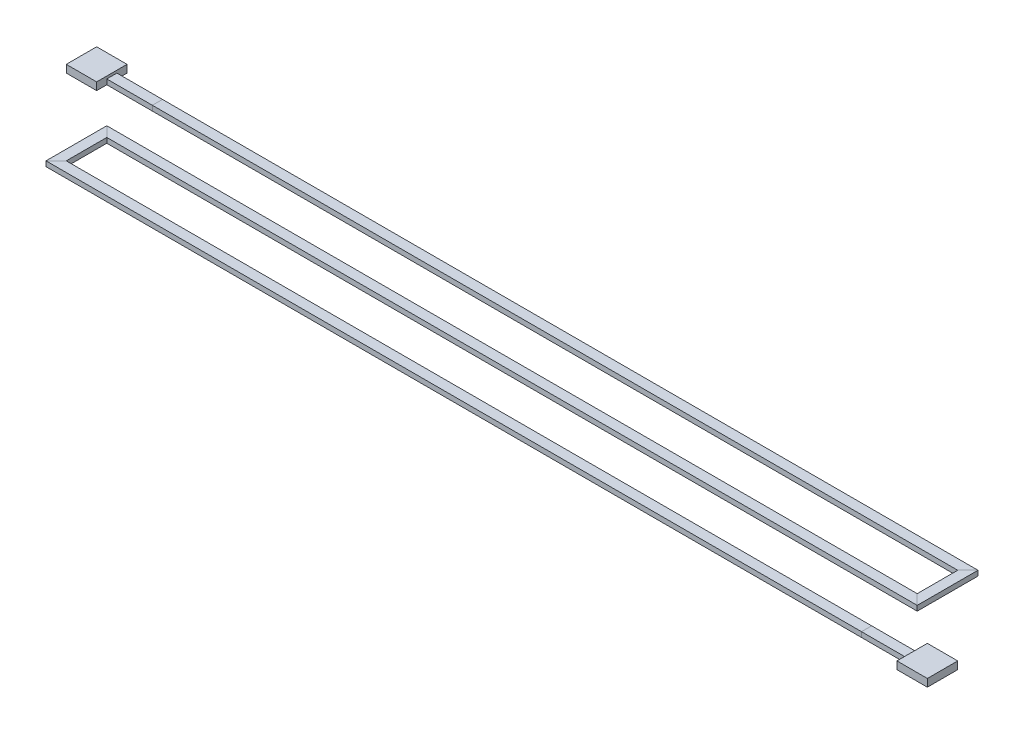
from build123d import *

# Parameters (mm, degrees)
SKETCH2_W           = 1
SKETCH2_H           = 0.5
SKETCH3_W           = 3
SKETCH3_H           = 3
BOSS_EXTRUDE1_DEPTH = 0.75


with BuildPart() as part:
    # Sweep1: sweep along a path in Sketch1
    with BuildLine(Plane(origin=(0, 0, 0), x_dir=(1, 0, 0), z_dir=(0, 1, 0))) as sweep1_path:
        Line((-46.555555556, 5), (-40.555555556, 5))
        Line((-40.555555556, 5), (39.444444444, 5))
        Line((39.444444444, 5), (39.444444444, 0))
        Line((39.444444444, 0), (-40.555555556, 0))
        Line((-40.555555556, 0), (-40.555555556, -5))
        Line((-40.555555556, -5), (39.444444444, -5))
        Line((39.444444444, -5), (45.444444444, -5))
    # Sketch2 → Sweep1 (sweep)
    with BuildSketch(Plane(origin=(45.444444444, 0, 0), x_dir=(0, 0, -1), z_dir=(1, 0, 0))):
        with Locations((-5, 0)):
            Rectangle(SKETCH2_W, SKETCH2_H)
    sweep(path=sweep1_path.line, transition=Transition.RIGHT)

    # Sketch3 → Boss-Extrude1 (add)
    with BuildSketch(Plane.XZ.offset(0.25)):
        with Locations((-46.555555556, -5)):
            Rectangle(SKETCH3_W, SKETCH3_H)
        with Locations((45.444444444, 5)):
            Rectangle(SKETCH3_W, SKETCH3_H)
    extrude(amount=-BOSS_EXTRUDE1_DEPTH)


solid = part.part
